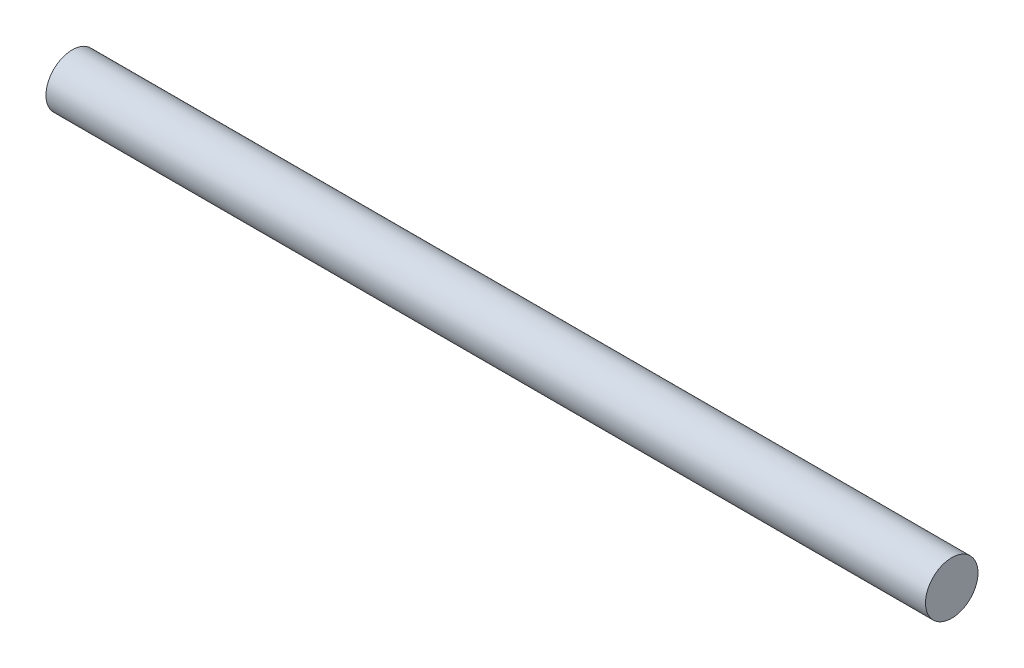
from build123d import *

# Parameters (mm, degrees)
SKETCH1_R           = 4
BOSS_EXTRUDE1_DEPTH = 134


with BuildPart() as part:
    # Sketch1 → Boss-Extrude1 (new body)
    with BuildSketch(Plane(origin=(0, 0, 0), x_dir=(0, 0, -1), z_dir=(1, 0, 0))):
        Circle(SKETCH1_R)
    extrude(amount=BOSS_EXTRUDE1_DEPTH)


solid = part.part
